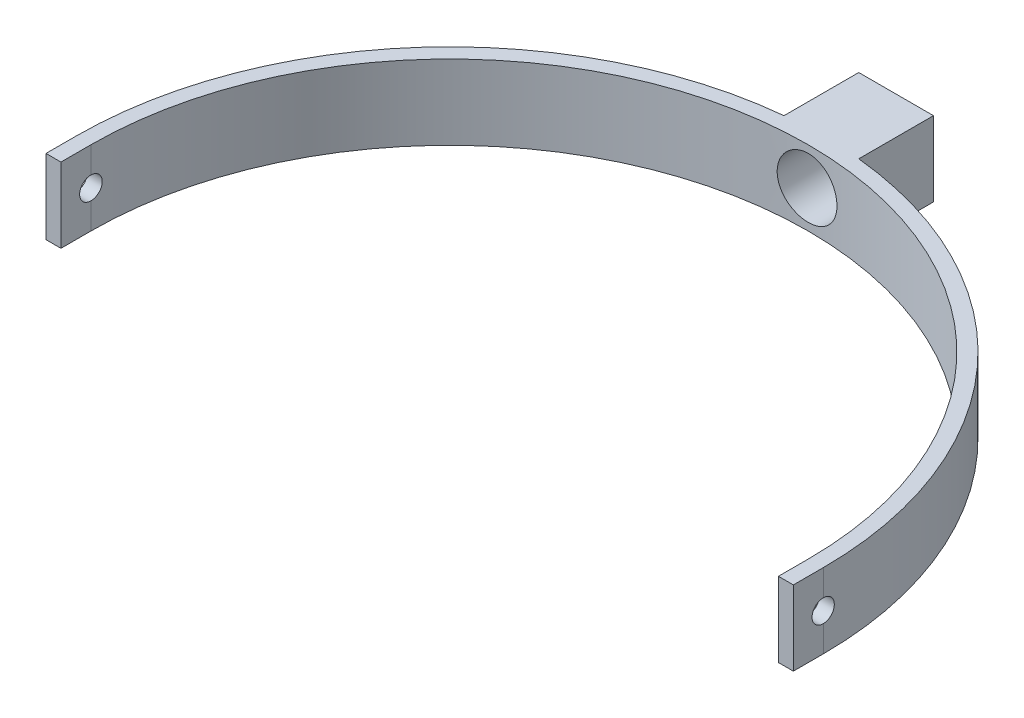
from build123d import *

# Parameters (mm, degrees)
BOSS_EXTRUDE1_DEPTH = 50
SKETCH2_R           = 20
CUT_EXTRUDE1_DEPTH  = 409.166094009
SKETCH3_R           = 7.5
CUT_EXTRUDE2_DEPTH  = 585.593607558


with BuildPart() as part:
    # Sketch1 → Boss-Extrude1 (new body)
    with BuildSketch(Plane(origin=(0, 0, 0), x_dir=(1, 0, 0), z_dir=(0, 1, 0))):
        with BuildLine():
            Line((-25, 298.746859277), (25, 298.746859277))
            Line((25, 298.746859277), (25, 248.746859277))
            ThreePointArc((25, 248.746859277), (185.404962177, 167.705098312), (250, 0))
            Line((250, 0), (250, -20))
            Line((250, -20), (240, -20))
            Line((240, -20), (240, 0))
            ThreePointArc((240, 0), (0, 240), (-240, 0))
            Line((-240, 0), (-240, -20))
            Line((-240, -20), (-250, -20))
            Line((-250, -20), (-250, 0))
            ThreePointArc((-250, 0), (-185.404962177, 167.705098312), (-25, 248.746859277))
            Line((-25, 248.746859277), (-25, 298.746859277))
        make_face()
    extrude(amount=BOSS_EXTRUDE1_DEPTH)

    # Sketch2 → Cut-Extrude1 (cut, through all)
    with BuildSketch(Plane(origin=(0, 0, -298.746859277), x_dir=(-1, 0, 0), z_dir=(0, 0, -1))):
        with Locations((0, 25)):
            Circle(SKETCH2_R)
    extrude(amount=-CUT_EXTRUDE1_DEPTH, mode=Mode.SUBTRACT)

    # Sketch3 → Cut-Extrude2 (cut, through all)
    with BuildSketch(Plane.ZY.offset(250)):
        with Locations((0, 25)):
            Circle(SKETCH3_R)
    extrude(amount=-CUT_EXTRUDE2_DEPTH, mode=Mode.SUBTRACT)


solid = part.part
